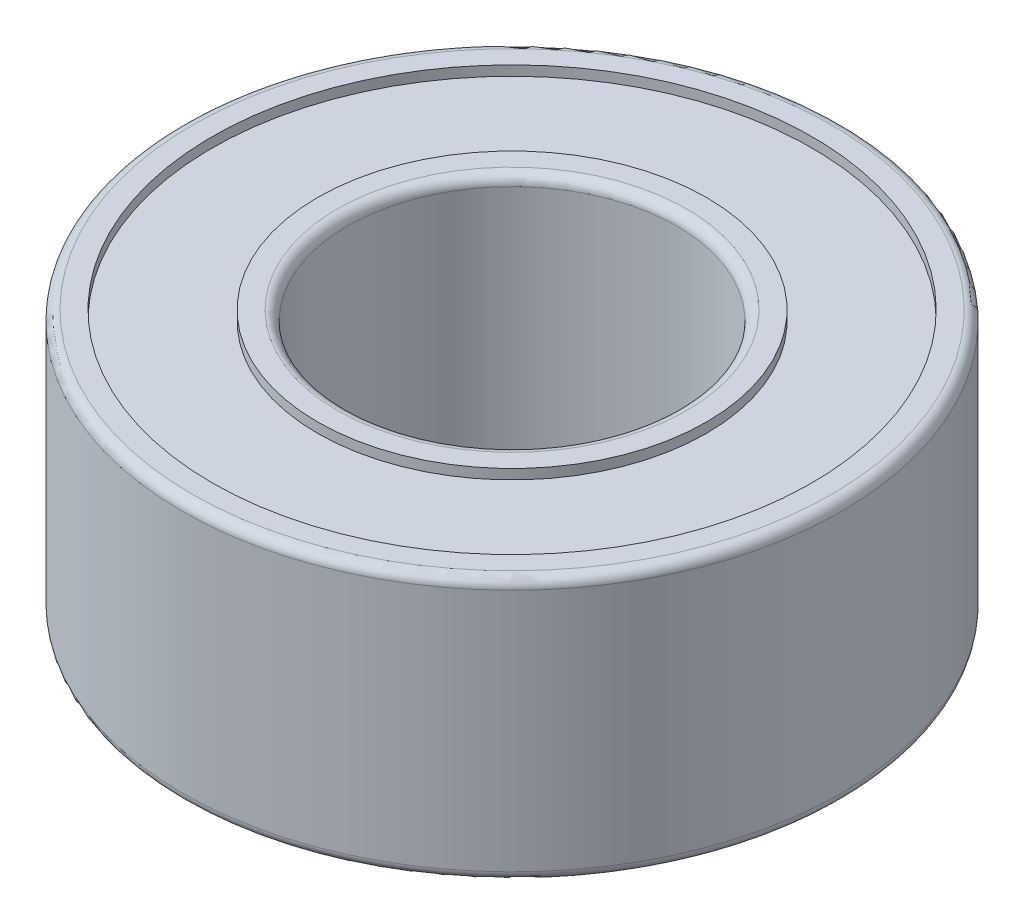
from build123d import *


with BuildPart() as part:
    # Esquisse1 → Révolution1 (revolve)
    with BuildSketch(Plane(origin=(0, 0, 0), x_dir=(-1, 0, 0), z_dir=(0, 0, -1)), mode=Mode.PRIVATE) as r_volution1_sk:
        with BuildLine():
            Line((-2.5, -1.85), (-2.5, 1.85))
            ThreePointArc((-2.5, 1.85), (-2.543933983, 1.956066017), (-2.65, 2))
            Line((-2.65, 2), (-2.95, 2))
            Line((-2.95, 2), (-2.95, 1.85))
            Line((-2.95, 1.85), (-4.55, 1.85))
            Line((-4.55, 1.85), (-4.55, 2))
            Line((-4.55, 2), (-4.85, 2))
            ThreePointArc((-4.85, 2), (-4.956066017, 1.956066017), (-5, 1.85))
            Line((-5, 1.85), (-5, -1.85))
            ThreePointArc((-5, -1.85), (-4.956066017, -1.956066017), (-4.85, -2))
            Line((-4.85, -2), (-4.55, -2))
            Line((-4.55, -2), (-4.55, -1.85))
            Line((-4.55, -1.85), (-2.95, -1.85))
            Line((-2.95, -1.85), (-2.95, -2))
            Line((-2.95, -2), (-2.65, -2))
            ThreePointArc((-2.65, -2), (-2.543933983, -1.956066017), (-2.5, -1.85))
        make_face()
    revolve(r_volution1_sk.sketch.rotate(Axis((0, -2.003446066, 0), (0, 1, 0)), 270), axis=Axis((0, -2.003446066, 0), (0, 1, 0)))


solid = part.part
